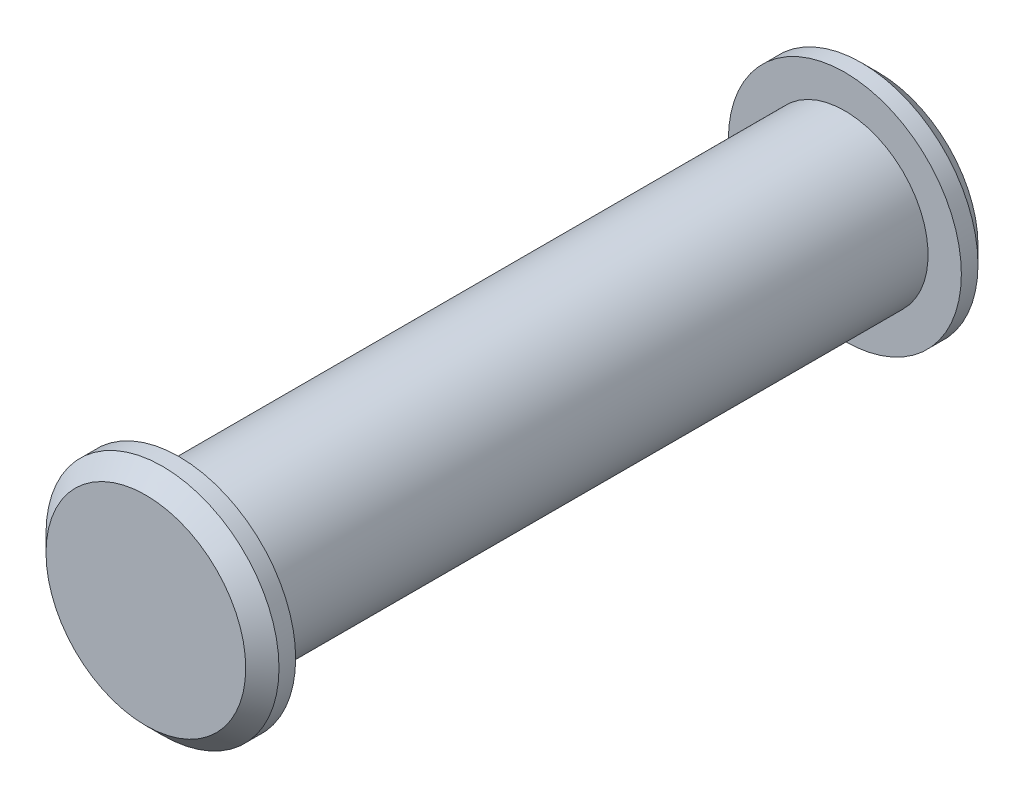
from build123d import *

# Parameters (mm, degrees)
SKETCH1_R           = 2.5
BOSS_EXTRUDE1_DEPTH = 10
SKETCH2_R           = 3.5
BOSS_EXTRUDE2_DEPTH = 1
CHAMFER1_SIZE       = 0.5


with BuildPart() as part:
    # Sketch1 → Boss-Extrude1 (new, symmetric)
    with BuildSketch(Plane.XY):
        Circle(SKETCH1_R)
    extrude(amount=BOSS_EXTRUDE1_DEPTH, both=True)

    # Sketch2 → Boss-Extrude2 (add)
    with BuildSketch(Plane.XY.offset(10)):
        Circle(SKETCH2_R)
    boss_extrude2 = extrude(amount=BOSS_EXTRUDE2_DEPTH)

    # Mirror1: Boss-Extrude2 across plane
    add(boss_extrude2.mirror(Plane.XY))

    # Chamfer1
    chamfer1_edges = [part.edges().sort_by_distance(p)[0] for p in [
        (-3.5, 0, 11),
        (-3.5, 0, -11),
    ]]
    chamfer(chamfer1_edges, length=CHAMFER1_SIZE)


solid = part.part
